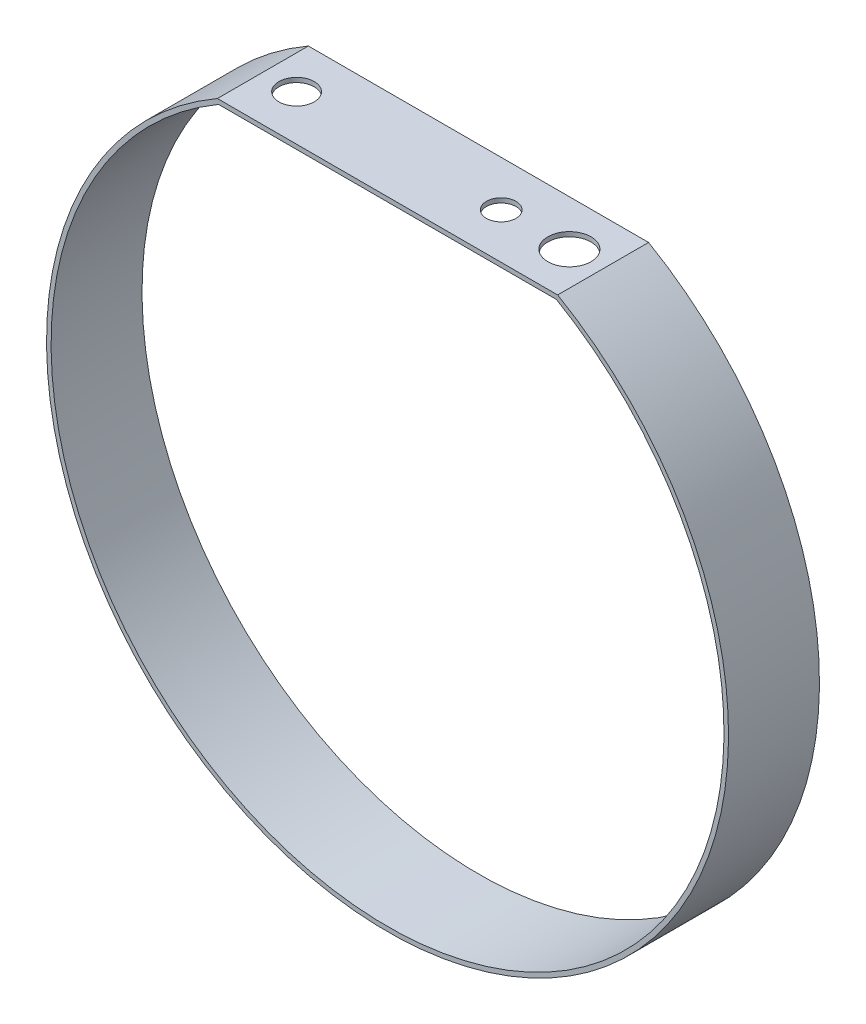
from build123d import *

# Parameters (mm, degrees)
BOSS_EXTRU_1_DEPTH      = 40
ENL_V_MAT_EXTRU_1_REACH = 322.156
ESQUISSE2_R             = 9.5
ESQUISSE2_R_2           = 7.75
ESQUISSE2_R_3           = 6.5


with BuildPart() as part:
    # Esquisse1 → Boss.-Extru.1 (new body)
    with BuildSketch(Plane.XY):
        with BuildLine():
            Line((-74.833147735, 130), (74.833147735, 130))
            ThreePointArc((74.833147735, 130), (0, -150), (-74.833147735, 130))
        make_face()
        with BuildLine():
            Line((-74.296702484, 128), (74.296702484, 128))
            ThreePointArc((74.296702484, 128), (0, -148), (-74.296702484, 128))
        make_face(mode=Mode.SUBTRACT)
    extrude(amount=BOSS_EXTRU_1_DEPTH)

    # Esquisse2 → Enlèv. mat.-Extru.1 (cut, up to next)
    with BuildSketch(Plane(origin=(0, 130, 0), x_dir=(1, 0, 0), z_dir=(0, 1, 0)), mode=Mode.PRIVATE) as enl_v_mat_extru_1_sk1:
        with Locations(Location((60, -20, 0), (0, 0, 270))):
            Circle(ESQUISSE2_R)
    enl_v_mat_extru_1_tool1 = extrude(enl_v_mat_extru_1_sk1.sketch, amount=-ENL_V_MAT_EXTRU_1_REACH, mode=Mode.PRIVATE) & part.part
    # Esquisse2 → Enlèv. mat.-Extru.1 (cut, up to next)
    with BuildSketch(Plane(origin=(0, 130, 0), x_dir=(1, 0, 0), z_dir=(0, 1, 0)), mode=Mode.PRIVATE) as enl_v_mat_extru_1_sk2:
        with Locations(Location((-60, -20, 0), (0, 0, 270))):
            Circle(ESQUISSE2_R_2)
    enl_v_mat_extru_1_tool2 = extrude(enl_v_mat_extru_1_sk2.sketch, amount=-ENL_V_MAT_EXTRU_1_REACH, mode=Mode.PRIVATE) & part.part
    # Esquisse2 → Enlèv. mat.-Extru.1 (cut, up to next)
    with BuildSketch(Plane(origin=(0, 130, 0), x_dir=(1, 0, 0), z_dir=(0, 1, 0)), mode=Mode.PRIVATE) as enl_v_mat_extru_1_sk3:
        with Locations(Location((30, -20, 0), (0, 0, 270))):
            Circle(ESQUISSE2_R_3)
    enl_v_mat_extru_1_tool3 = extrude(enl_v_mat_extru_1_sk3.sketch, amount=-ENL_V_MAT_EXTRU_1_REACH, mode=Mode.PRIVATE) & part.part
    add(enl_v_mat_extru_1_tool1.solids().sort_by_distance((60, 130, 20))[0], mode=Mode.SUBTRACT)
    add(enl_v_mat_extru_1_tool2.solids().sort_by_distance((-60, 130, 20))[0], mode=Mode.SUBTRACT)
    add(enl_v_mat_extru_1_tool3.solids().sort_by_distance((30, 130, 20))[0], mode=Mode.SUBTRACT)


solid = part.part
